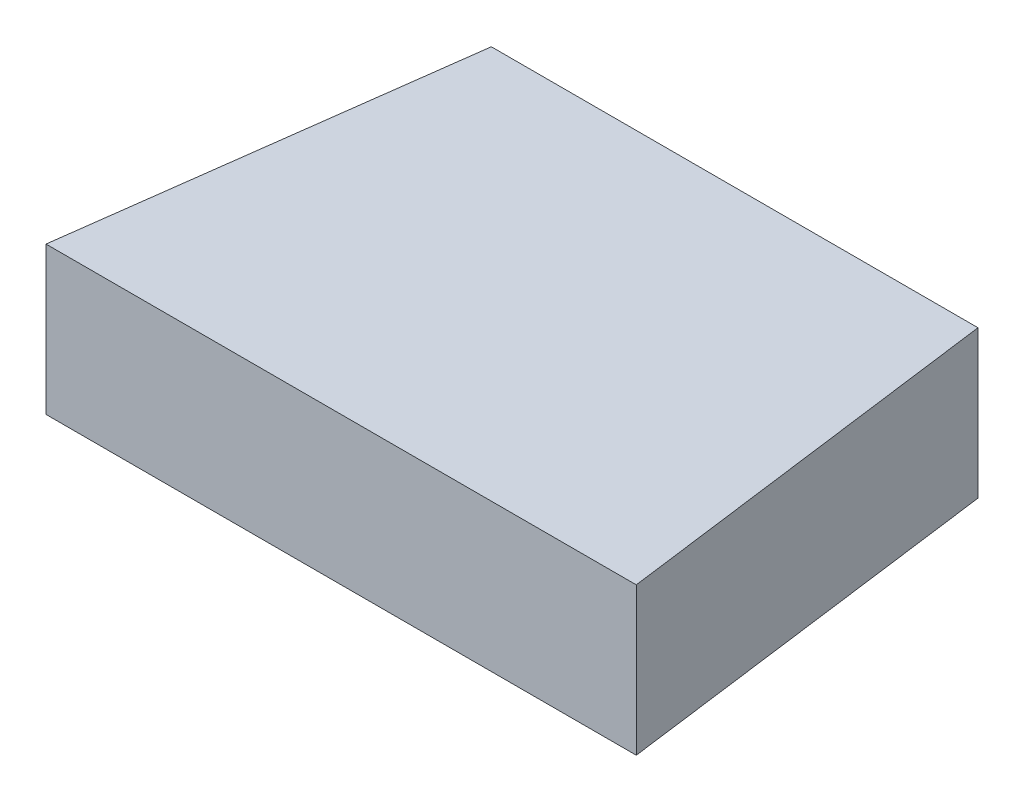
from build123d import *

# Parameters (mm, degrees)
BOSS_EXTRUDE1_DEPTH = 19.05


with BuildPart() as part:
    # Sketch1 → Boss-Extrude1 (new body)
    with BuildSketch(Plane(origin=(0, 0, 0), x_dir=(1, 0, 0), z_dir=(0, 1, 0))):
        Polygon((-38.1, -289.398231695), (38.1, -289.398231695), (31.412053123, -238.598231695), (-31.412053123, -238.598231695), align=None)
    extrude(amount=BOSS_EXTRUDE1_DEPTH)


solid = part.part
